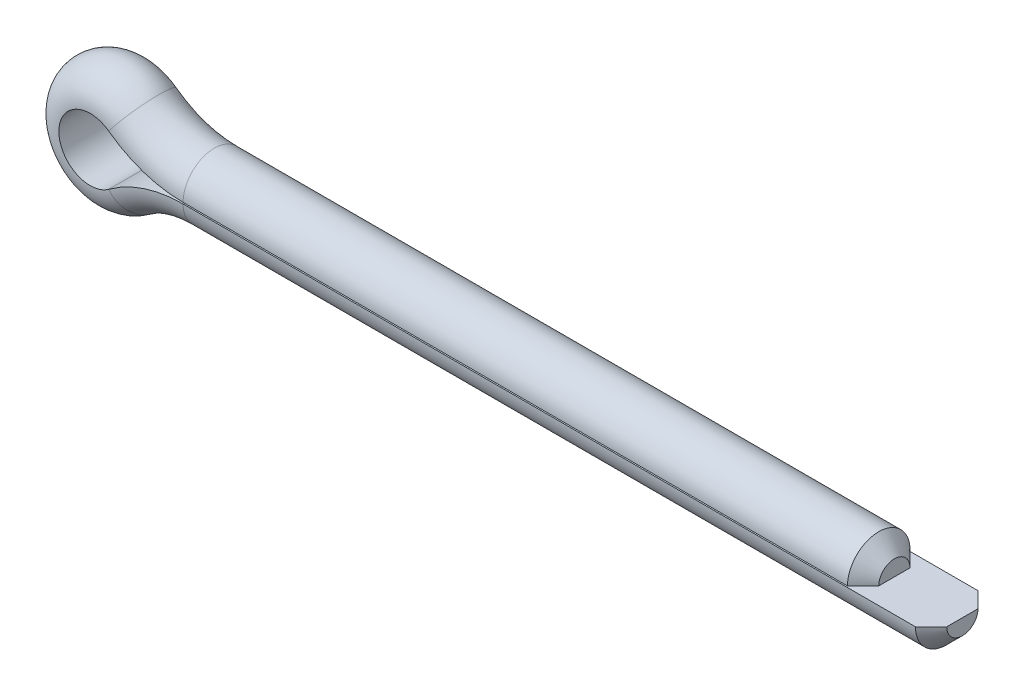
from build123d import *

# Parameters (mm, degrees)
CHAMFER1_SIZE = 0.575


with BuildPart() as part:
    # Sweep1: sweep along a path in Sketch1
    with BuildLine(Plane.XY) as sweep1_path:
        Line((2.5, -0.0254), (-25, -0.0254))
        ThreePointArc((-25, -0.0254), (-26.438493657, -0.25610532), (-27.732696818, -0.92508))
        ThreePointArc((-27.732696818, -0.92508), (-29.565871022, 0), (-27.732696818, 0.92508))
        ThreePointArc((-27.732696818, 0.92508), (-26.438493657, 0.25610532), (-25, 0.0254))
        Line((-25, 0.0254), (0, 0.0254))
    # Sketch2 → Sweep1 (sweep)
    with BuildSketch(Plane(origin=(0, 0, 0), x_dir=(0, 0, -1), z_dir=(1, 0, 0))):
        with BuildLine():
            Line((-1.15, 0.0254), (1.15, 0.0254))
            ThreePointArc((1.15, 0.0254), (0, 1.1754), (-1.15, 0.0254))
        make_face()
    sweep(path=sweep1_path.line)

    # Chamfer1
    chamfer1_edges = [part.edges().sort_by_distance(p)[0] for p in [
        (2.5, -1.1754, 0),
        (0, 1.1754, 0),
    ]]
    chamfer(chamfer1_edges, length=CHAMFER1_SIZE)


solid = part.part
